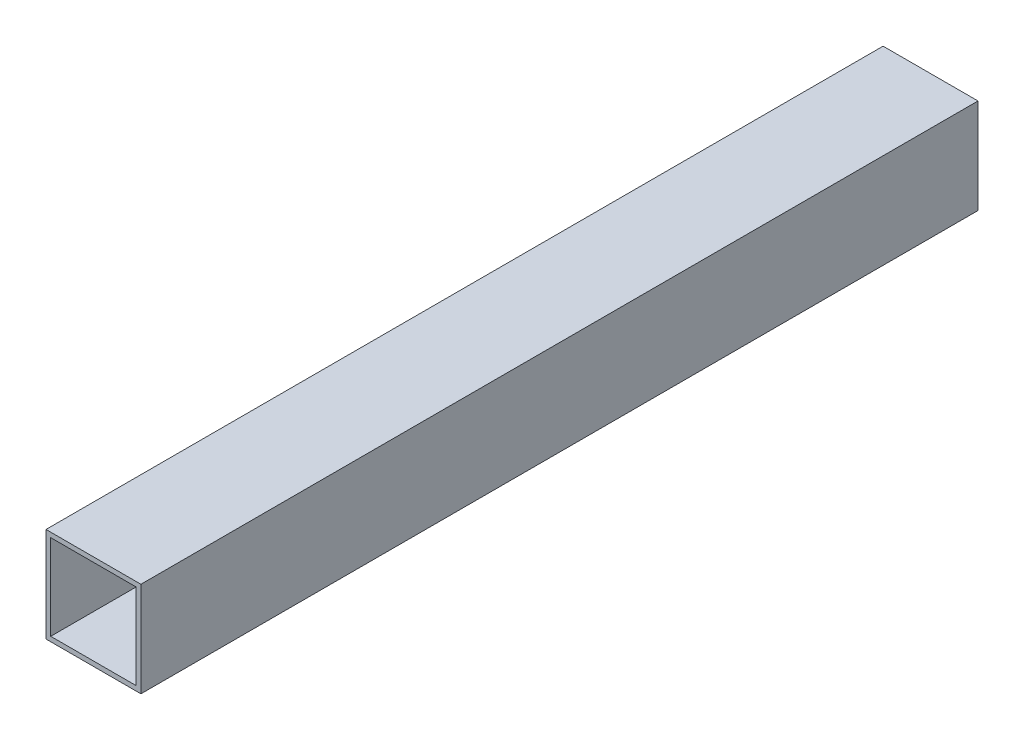
from build123d import *

# Parameters (mm, degrees)
SKETCH1_W           = 31.75
SKETCH1_H           = 31.75
SKETCH1_W_2         = 28.575
SKETCH1_H_2         = 28.575
BOSS_EXTRUDE1_DEPTH = 280


with BuildPart() as part:
    # Sketch1 → Boss-Extrude1 (new body)
    with BuildSketch(Plane.XY):
        Rectangle(SKETCH1_W, SKETCH1_H)
        Rectangle(SKETCH1_W_2, SKETCH1_H_2, mode=Mode.SUBTRACT)
    extrude(amount=BOSS_EXTRUDE1_DEPTH)


solid = part.part
